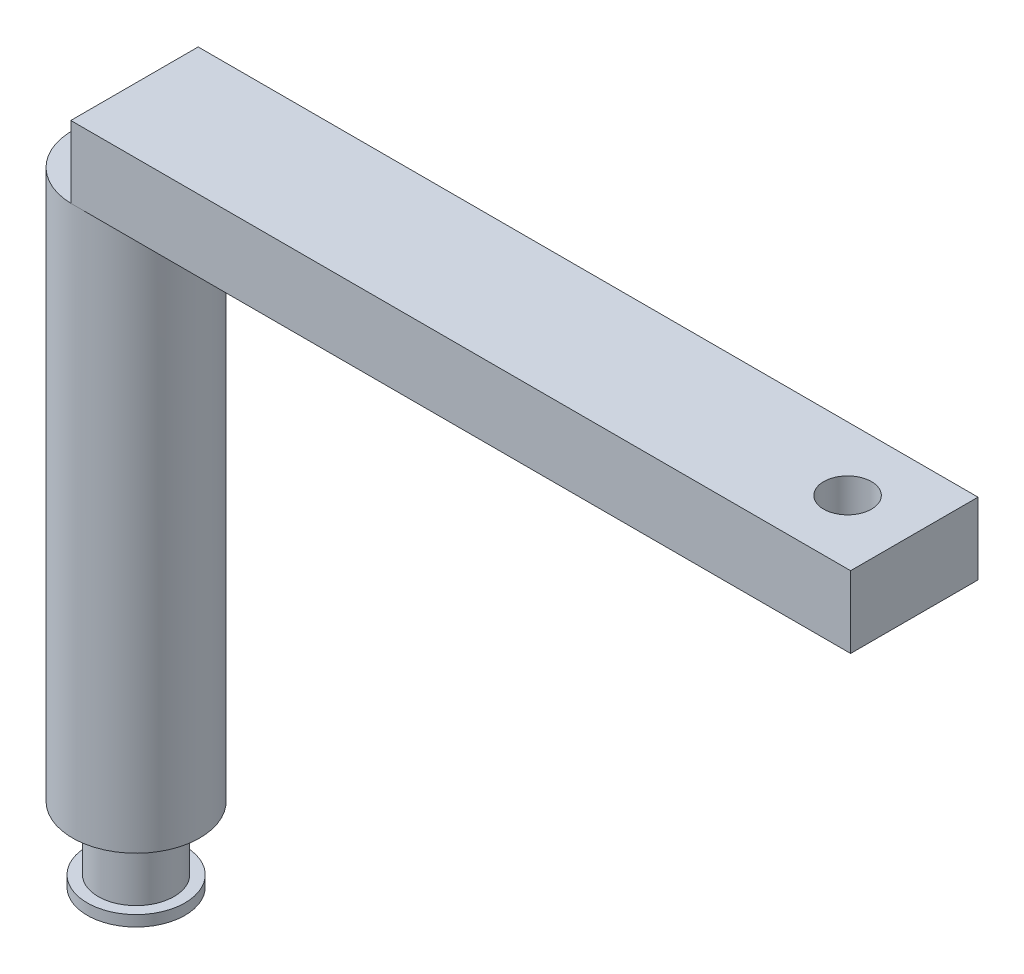
from build123d import *

# Parameters (mm, degrees)
BOSS_EXTRUDE1_DEPTH     = 1.5
CUT_EXTRUDE1_DEPTH      = 41.754559874
CUT_EXTRUDE1_DEPTH_BACK = 41.754559874
SKETCH6_R               = 0.5


with BuildPart() as part:
    # Sketch1 → Revolve1 (revolve)
    with BuildSketch(Plane(origin=(-14.777648988, 30.214835565, 34.561537757), x_dir=(-0.025322831104622072, 0, 0.9996793256964189), z_dir=(0.9996793256964189, 0, 0.025322831104622072)), mode=Mode.PRIVATE) as revolve1_sk:
        Polygon((0.538461916, -0.016033073), (-0.794313715, -0.016033073), (-0.794313715, 12.79633963), (-0.794313715, 13.022686392), (0.228391261, 13.022686392), (0.228391261, 12.79633963), (-0.000563715, 12.79633963), (-0.000563715, 11.466008099), (0.538461916, 11.466008099), align=None)
    revolve(revolve1_sk.sketch.rotate(Axis((-14.757534716, 30.388488917, 33.767478758), (0, 1, 0)), 181.451046455), axis=Axis((-14.757534716, 30.388488917, 33.767478758), (0, 1, 0)))

    # Sketch5 → Boss-Extrude1 (add)
    with BuildSketch(Plane(origin=(0, 30.230868638, 0), x_dir=(1, 0, 0), z_dir=(0, 1, 0))):
        Polygon((-14.723785064, -32.435130513), (-14.791284368, -32.435130513), (-14.791284368, -35.099827002), (-14.723785064, -35.099827002), (1.521158766, -35.099827002), (1.521158766, -32.435130513), align=None)
    extrude(amount=BOSS_EXTRUDE1_DEPTH)

    # Sketch6 → Cut-Extrude1 (cut, two sides: drawn at the far end of the back side and taken through both)
    with BuildSketch(Plane.XZ.offset(-30.230868638).offset(-CUT_EXTRUDE1_DEPTH_BACK)):
        with Locations(Location((0.125166735, 33.767478758, 0), (0, 0, 90))):
            Circle(SKETCH6_R)
    extrude(amount=CUT_EXTRUDE1_DEPTH + CUT_EXTRUDE1_DEPTH_BACK, mode=Mode.SUBTRACT)


solid = part.part
